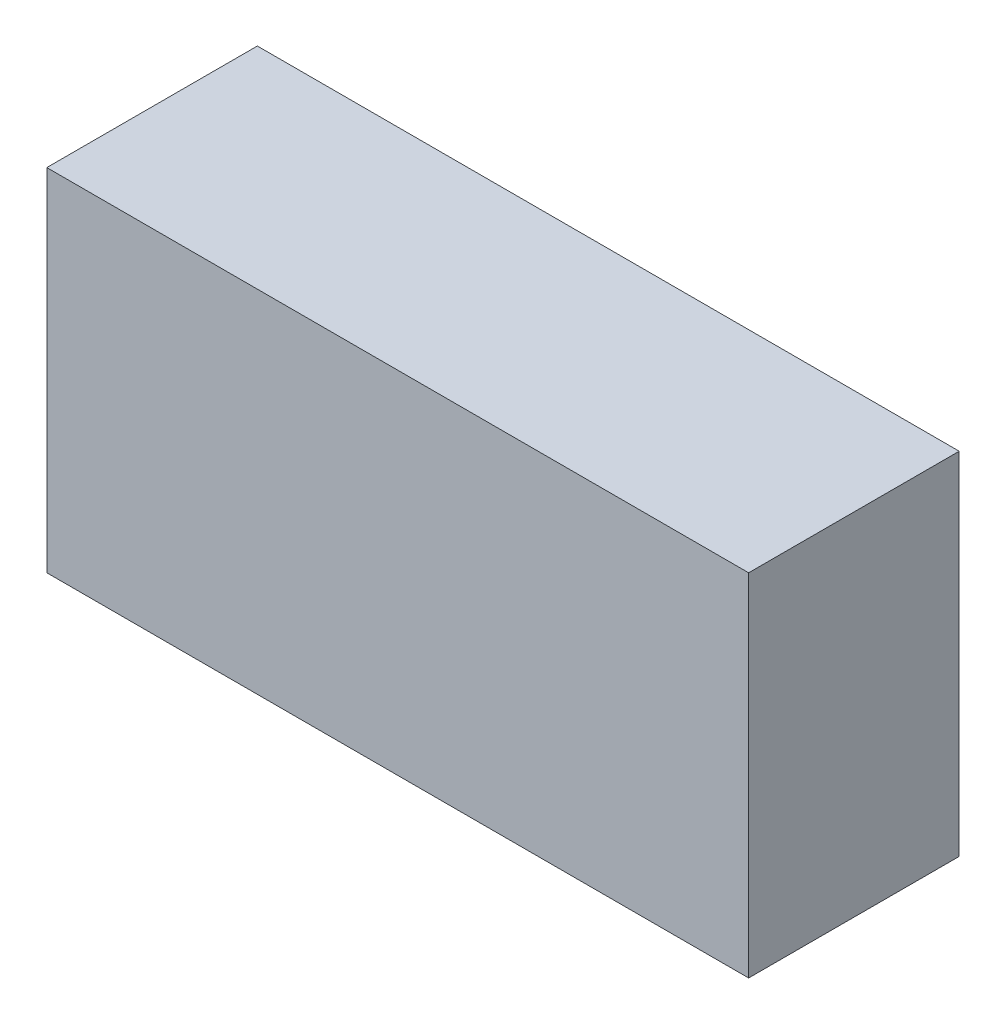
from build123d import *

# Parameters (mm, degrees)
RECTANGLESKETCH_W = 40
RECTANGLESKETCH_H = 20
BLINDBOSS_DEPTH   = 12


with BuildPart() as part:
    # RectangleSketch → BlindBoss (new body)
    with BuildSketch(Plane.XY):
        with Locations((20, 10)):
            Rectangle(RECTANGLESKETCH_W, RECTANGLESKETCH_H)
    extrude(amount=BLINDBOSS_DEPTH)


solid = part.part
